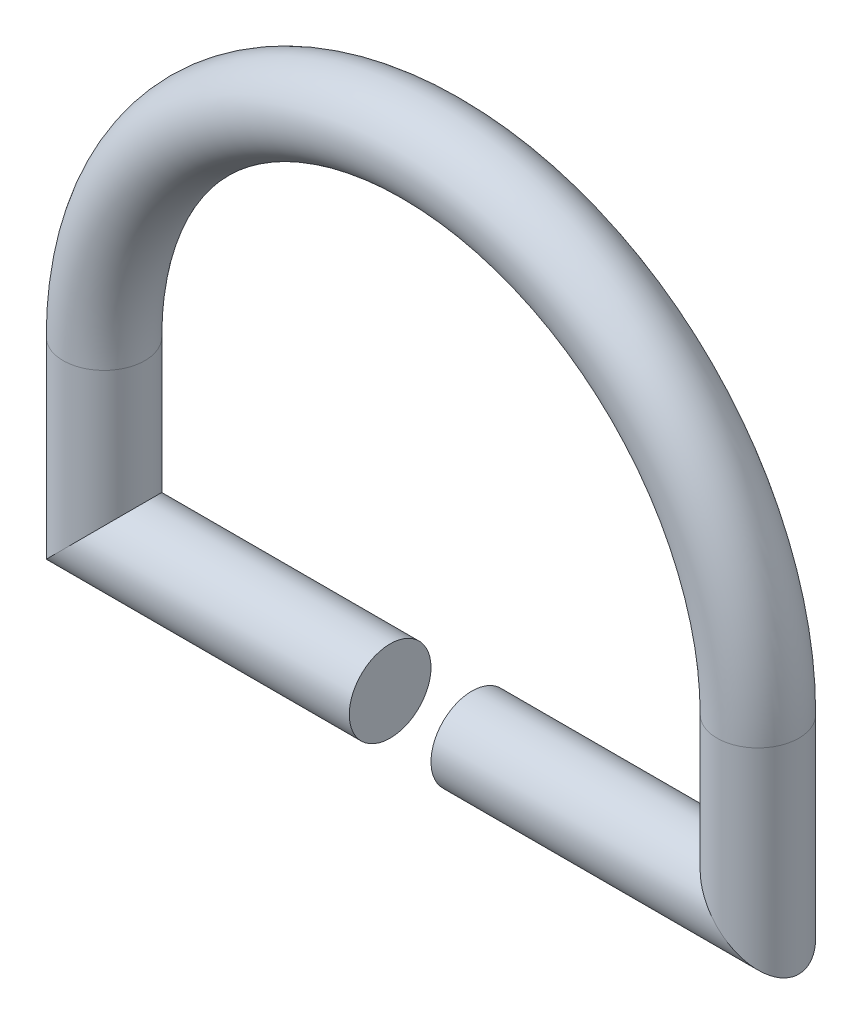
from build123d import *

# Parameters (mm, degrees)
SKETCH_2_R = 0.5


with BuildPart() as part:
    # 扫描1: sweep along a path in 草图1
    with BuildLine(Plane.XY) as sweep_1_path:
        Line((-0.5, 0), (-4, 0))
        Line((-4, 0), (-4, 2))
        ThreePointArc((-4, 2), (0, 6), (4, 2))
        Line((4, 2), (4, 0))
        Line((4, 0), (0.5, 0))
    # 草图2 → 扫描1 (sweep)
    with BuildSketch(Plane(origin=(-0.5, 0, 0), x_dir=(0, 0, -1), z_dir=(1, 0, 0))):
        Circle(SKETCH_2_R)
    sweep(path=sweep_1_path.line, transition=Transition.RIGHT)


solid = part.part
